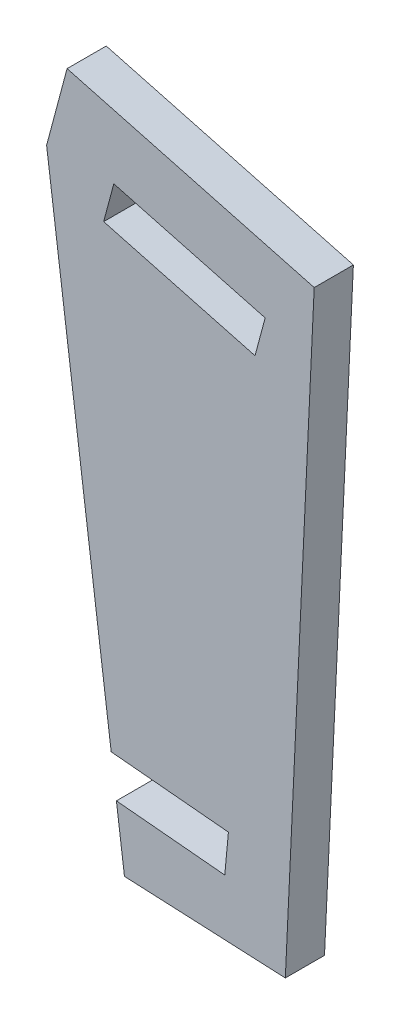
from build123d import *

# Parameters (mm, degrees)
BASE_EXTRUDE_DEPTH = 3


with BuildPart() as part:
    # Sketch1 → Base-Extrude (new body)
    with BuildSketch(Plane.XY):
        Polygon((156.049697038, -56.981976311), (160.995963781, -94.739977013), (169.973055579, -95.576486697), (169.694713282, -98.563546383), (161.395541391, -97.790207109), (162.011434279, -102.491709341), (174.332527404, -103.072899505), (176.544882919, -56.17148924), (157.617642362, -51.114031919), align=None)
        Polygon((160.419784952, -59.862246689), (172.013048365, -62.960027094), (172.787493466, -60.061711241), (161.194230053, -56.963930836), align=None, mode=Mode.SUBTRACT)
    extrude(amount=BASE_EXTRUDE_DEPTH)


solid = part.part
